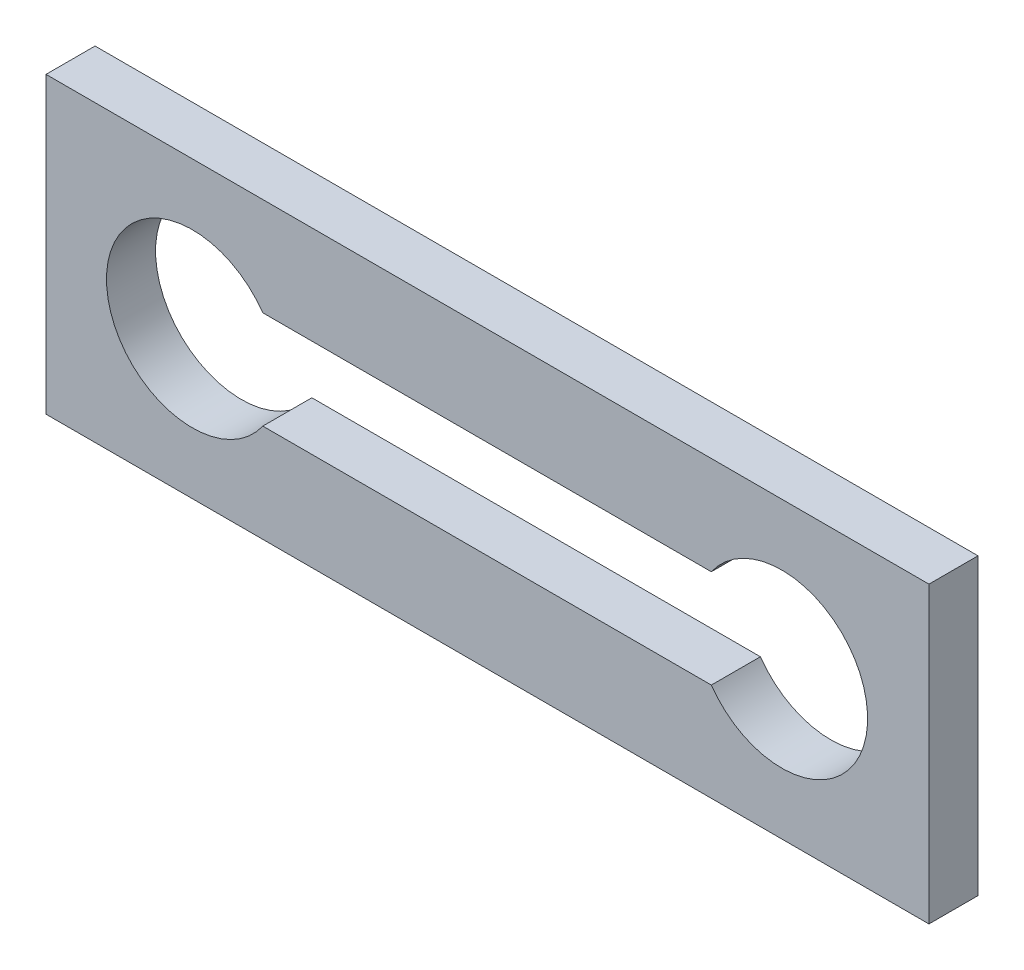
from build123d import *

# Parameters (mm, degrees)
SKETCH1_W           = 114.3
SKETCH1_H           = 38.1
BOSS_EXTRUDE1_DEPTH = 6.35
SKETCH2_R           = 11.1125
CUT_EXTRUDE1_DEPTH  = 61.57513929
SKETCH3_W           = 66.543997706
SKETCH3_H           = 12.7
CUT_EXTRUDE2_DEPTH  = 61.57513929


with BuildPart() as part:
    # Sketch1 → Boss-Extrude1 (new body)
    with BuildSketch(Plane.XY):
        Rectangle(SKETCH1_W, SKETCH1_H)
    extrude(amount=BOSS_EXTRUDE1_DEPTH)

    # Sketch2 → Cut-Extrude1 (cut, through all)
    with BuildSketch(Plane.XY.offset(6.35)):
        with Locations((-38.205321874, 0)):
            Circle(SKETCH2_R)
        with Locations((38.1, 0)):
            Circle(SKETCH2_R)
    extrude(amount=-CUT_EXTRUDE1_DEPTH, mode=Mode.SUBTRACT)

    # Sketch3 → Cut-Extrude2 (cut, through all)
    with BuildSketch(Plane.XY.offset(6.35)):
        Rectangle(SKETCH3_W, SKETCH3_H)
    extrude(amount=-CUT_EXTRUDE2_DEPTH, mode=Mode.SUBTRACT)


solid = part.part
